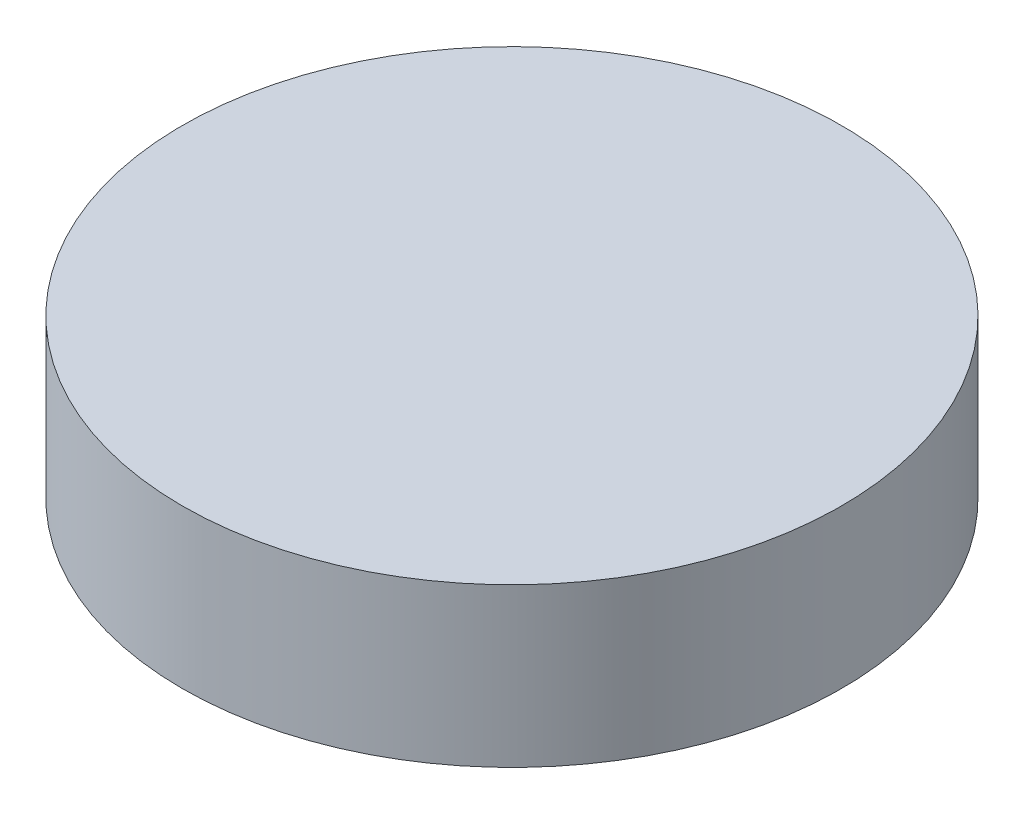
from build123d import *

# Parameters (mm, degrees)
SKETCH1_R               = 25
PACK_AYAR_AYAGI_4_DEPTH = 12


with BuildPart() as part:
    # Sketch1 → PACK_ayar_ayagi_4 (new body)
    with BuildSketch(Plane(origin=(0, 0, 0), x_dir=(1, 0, 0), z_dir=(0, 1, 0))):
        with Locations(Location((650, 770, 0), (0, 0, 270))):
            Circle(SKETCH1_R)
    extrude(amount=PACK_AYAR_AYAGI_4_DEPTH)


solid = part.part
